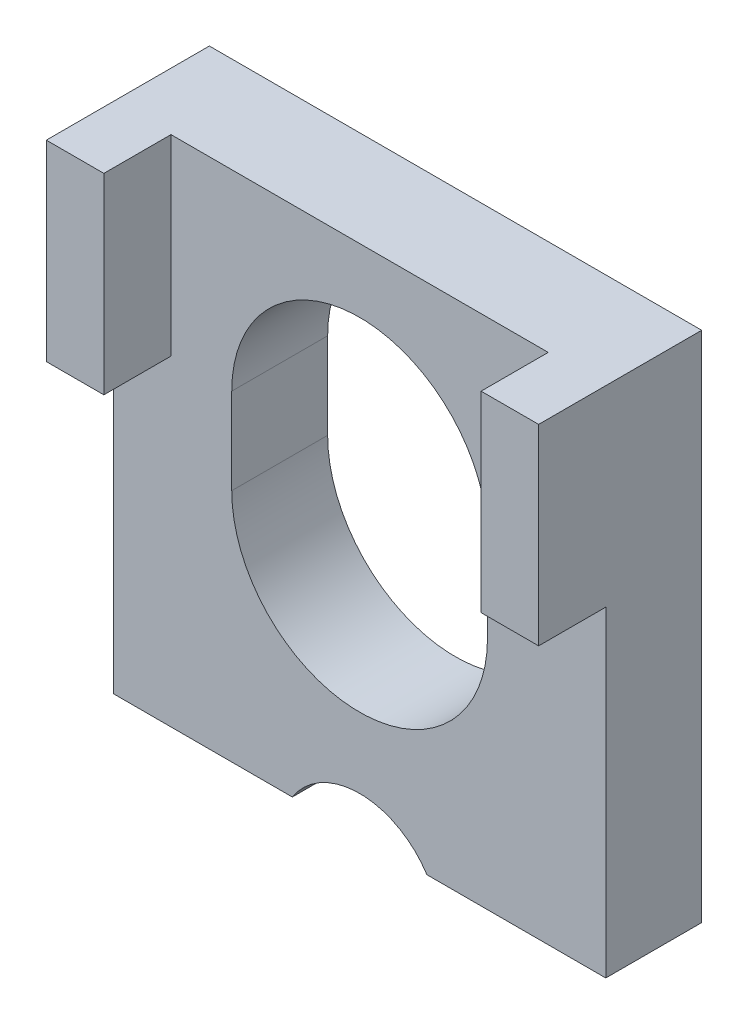
from build123d import *

# Parameters (mm, degrees)
EXTRUDE_1_DEPTH = 3
SKETCH_2_W      = 1.8
SKETCH_2_H      = 6
EXTRUDE_2_DEPTH = 2.1


with BuildPart() as part:
    # Эскиз1 → Бобышка-Вытянуть1 (new body)
    with BuildSketch(Plane.XY):
        with BuildLine():
            Line((-7.7, 13.737499607), (7.7, 13.737499607))
            Line((7.7, 13.737499607), (7.7, -0.039604792))
            Line((7.7, -0.039604792), (7.7, -2.309398114))
            Line((7.7, -2.309398114), (2.10443313, -2.309398114))
            ThreePointArc((2.10443313, -2.309398114), (0, -1.158976271), (-2.10443313, -2.309398114))
            Line((-2.10443313, -2.309398114), (-7.7, -2.309398114))
            Line((-7.7, -2.309398114), (-7.7, -0.039604792))
            Line((-7.7, -0.039604792), (-7.7, 13.737499607))
        make_face()
        with BuildLine():
            Line((4, 7.737499607), (4, 5.041023729))
            ThreePointArc((4, 5.041023729), (0, 1.041023729), (-4, 5.041023729))
            Line((-4, 5.041023729), (-4, 7.737499607))
            ThreePointArc((-4, 7.737499607), (0, 11.737499607), (4, 7.737499607))
        make_face(mode=Mode.SUBTRACT)
    extrude(amount=EXTRUDE_1_DEPTH)

    # Эскиз2 → Бобышка-Вытянуть2 (add)
    with BuildSketch(Plane.XY.offset(3)):
        with Locations((-6.8, 10.737499607)):
            Rectangle(SKETCH_2_W, SKETCH_2_H)
        with Locations((6.8, 10.737499607)):
            Rectangle(SKETCH_2_W, SKETCH_2_H)
    extrude(amount=EXTRUDE_2_DEPTH)


solid = part.part
